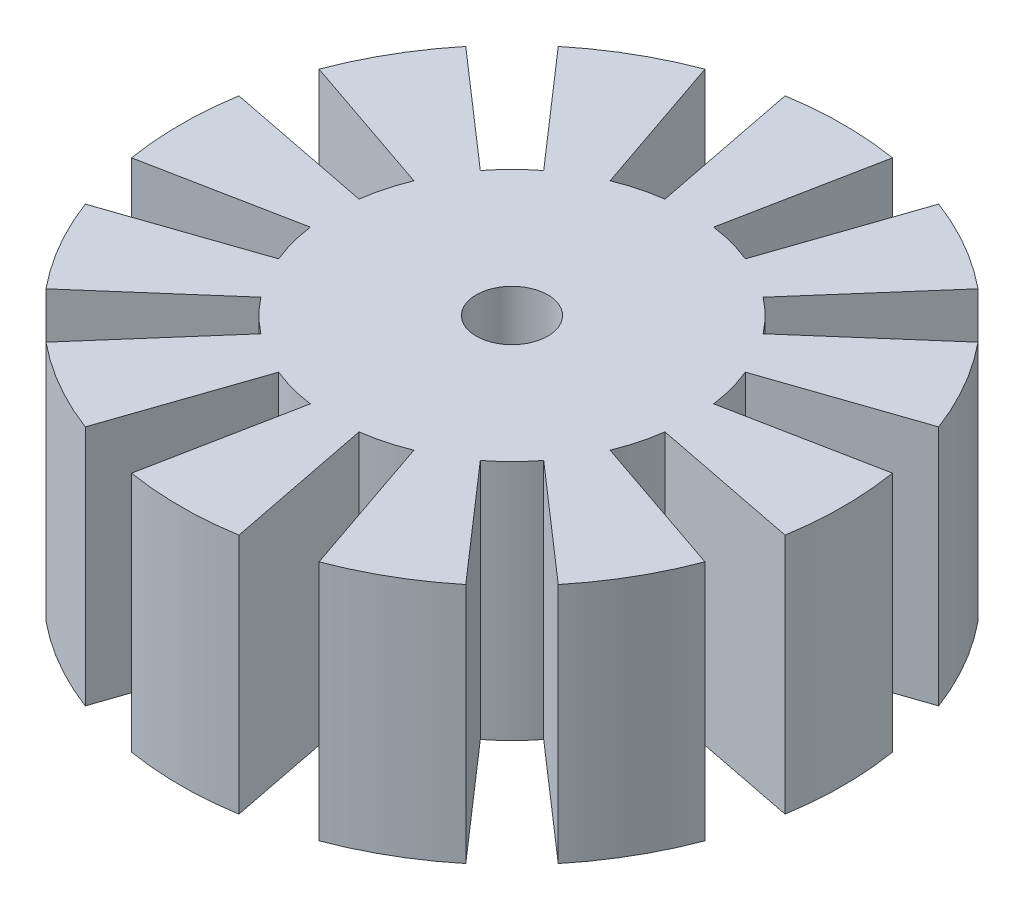
from build123d import *

# Parameters (mm, degrees)
SKETCH1_R           = 2
BOSS_EXTRUDE1_DEPTH = 13.5


with BuildPart() as part:
    # Sketch1 → Boss-Extrude1 (new body)
    with BuildSketch(Plane(origin=(0, 0, 0), x_dir=(1, 0, 0), z_dir=(0, 1, 0))):
        with BuildLine():
            Line((-16.314190392, -6.686200591), (-8.263943043, -3.933992685))
            ThreePointArc((-8.263943043, -3.933992685), (-8.664036901, -2.744899122), (-8.912092237, -1.51506696))
            Line((-8.912092237, -1.51506696), (-17.259914901, -3.156708671))
            ThreePointArc((-17.259914901, -3.156708671), (-17.504778638, -0.156708671), (-17.259914901, 2.843291329))
            Line((-17.259914901, 2.843291329), (-8.912092237, 1.201649618))
            ThreePointArc((-8.912092237, 1.201649618), (-8.664036901, 2.43148178), (-8.263943043, 3.620575343))
            Line((-8.263943043, 3.620575343), (-16.314190392, 6.372783249))
            ThreePointArc((-16.314190392, 6.372783249), (-15.026248608, 9.093291329), (-13.314190392, 11.568935672))
            Line((-13.314190392, 11.568935672), (-6.905584753, 5.973320915))
            ThreePointArc((-6.905584753, 5.973320915), (-6.07584645, 6.914359141), (-5.134808223, 7.744097445))
            Line((-5.134808223, 7.744097445), (-10.730422981, 14.152703083))
            ThreePointArc((-10.730422981, 14.152703083), (-8.254778638, 15.864761299), (-5.534270558, 17.152703083))
            Line((-5.534270558, 17.152703083), (-2.782062651, 9.102455734))
            ThreePointArc((-2.782062651, 9.102455734), (-1.592969089, 9.502549592), (-0.363136927, 9.750604929))
            Line((-0.363136927, 9.750604929), (-2.004778638, 18.098427593))
            ThreePointArc((-2.004778638, 18.098427593), (0.995221362, 18.343291329), (3.995221362, 18.098427593))
            Line((3.995221362, 18.098427593), (2.353579652, 9.750604929))
            ThreePointArc((2.353579652, 9.750604929), (3.583411813, 9.502549592), (4.772505376, 9.102455734))
            Line((4.772505376, 9.102455734), (7.524713283, 17.152703083))
            ThreePointArc((7.524713283, 17.152703083), (10.245221362, 15.864761299), (12.720865705, 14.152703083))
            Line((12.720865705, 14.152703083), (7.125250948, 7.744097445))
            ThreePointArc((7.125250948, 7.744097445), (8.066289174, 6.914359141), (8.896027478, 5.973320915))
            Line((8.896027478, 5.973320915), (15.304633116, 11.568935672))
            ThreePointArc((15.304633116, 11.568935672), (17.016691332, 9.093291329), (18.304633116, 6.372783249))
            Line((18.304633116, 6.372783249), (10.254385767, 3.620575343))
            ThreePointArc((10.254385767, 3.620575343), (10.654479625, 2.43148178), (10.902534962, 1.201649618))
            Line((10.902534962, 1.201649618), (19.250357626, 2.843291329))
            ThreePointArc((19.250357626, 2.843291329), (19.495221362, -0.156708671), (19.250357626, -3.156708671))
            Line((19.250357626, -3.156708671), (10.902534962, -1.51506696))
            ThreePointArc((10.902534962, -1.51506696), (10.654479625, -2.744899122), (10.254385767, -3.933992685))
            Line((10.254385767, -3.933992685), (18.304633116, -6.686200591))
            ThreePointArc((18.304633116, -6.686200591), (17.016691332, -9.406708671), (15.304633116, -11.882353014))
            Line((15.304633116, -11.882353014), (8.896027478, -6.286738257))
            ThreePointArc((8.896027478, -6.286738257), (8.066289174, -7.227776483), (7.125250948, -8.057514787))
            Line((7.125250948, -8.057514787), (12.720865705, -14.466120425))
            ThreePointArc((12.720865705, -14.466120425), (10.245221362, -16.178178641), (7.524713283, -17.466120425))
            Line((7.524713283, -17.466120425), (4.772505376, -9.415873076))
            ThreePointArc((4.772505376, -9.415873076), (3.583411813, -9.815966934), (2.353579652, -10.06402227))
            Line((2.353579652, -10.06402227), (3.995221362, -18.411844934))
            ThreePointArc((3.995221362, -18.411844934), (0.995221362, -18.656708671), (-2.004778638, -18.411844934))
            Line((-2.004778638, -18.411844934), (-0.363136927, -10.06402227))
            ThreePointArc((-0.363136927, -10.06402227), (-1.592969089, -9.815966934), (-2.782062651, -9.415873076))
            Line((-2.782062651, -9.415873076), (-5.534270558, -17.466120425))
            ThreePointArc((-5.534270558, -17.466120425), (-8.254778638, -16.178178641), (-10.730422981, -14.466120425))
            Line((-10.730422981, -14.466120425), (-5.134808223, -8.057514787))
            ThreePointArc((-5.134808223, -8.057514787), (-6.07584645, -7.227776483), (-6.905584753, -6.286738257))
            Line((-6.905584753, -6.286738257), (-13.314190392, -11.882353014))
            ThreePointArc((-13.314190392, -11.882353014), (-15.026248608, -9.406708671), (-16.314190392, -6.686200591))
        make_face()
        with Locations(Location((0.995221362, -0.156708671, 0), (0, 0, 270))):
            Circle(SKETCH1_R, mode=Mode.SUBTRACT)
    extrude(amount=BOSS_EXTRUDE1_DEPTH)


solid = part.part
